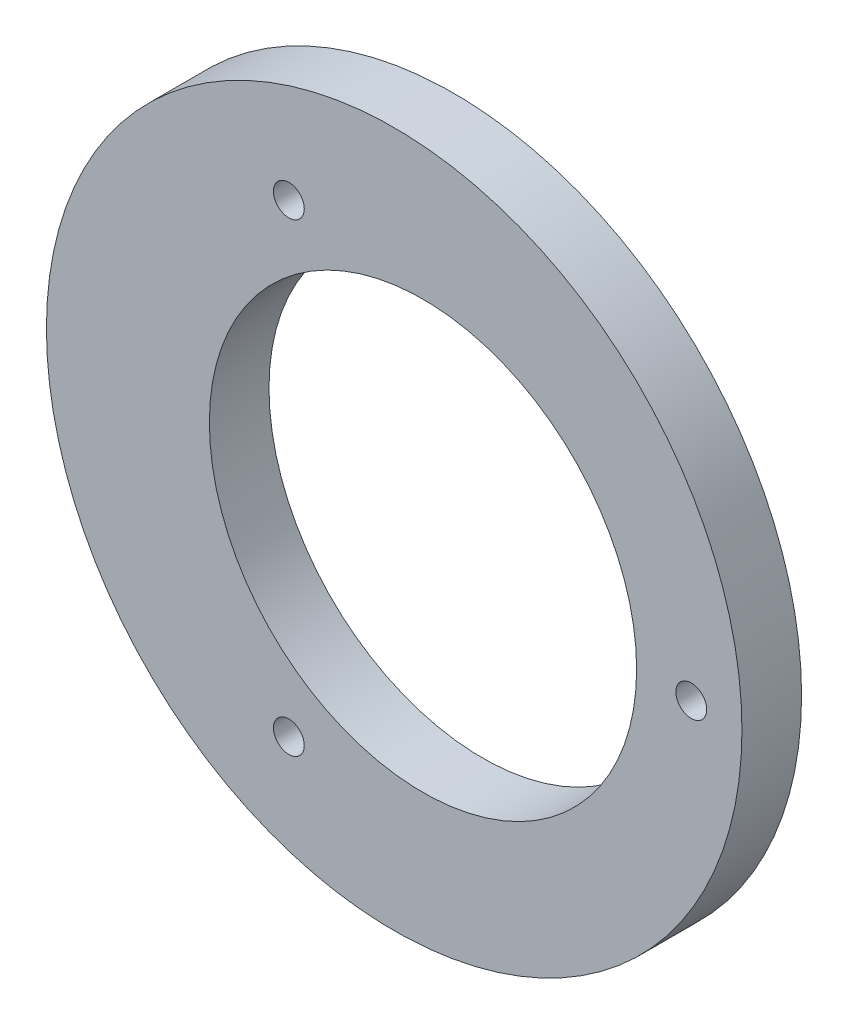
from build123d import *

# Parameters (mm, degrees)
SZKIC1_R                    = 35
DODANIE_WYCI_GNI_CIE1_DEPTH = 6
SZKIC3_R                    = 21.5
WYTNIJ_WYCI_GNI_CIE1_DEPTH  = 6
SZKIC4_R                    = 1.55
WYTNIJ_WYCI_GNI_CIE2_DEPTH  = 6


with BuildPart() as part:
    # Szkic1 → Dodanie-wyciągnięcie1 (new body)
    with BuildSketch(Plane.XY):
        with Locations((41.719839871, 20.384670663)):
            Circle(SZKIC1_R)
    extrude(amount=DODANIE_WYCI_GNI_CIE1_DEPTH)

    # Szkic3 → Wytnij-wyciągnięcie1 (cut)
    with BuildSketch(Plane.XY.offset(6)):
        with Locations((44.619839871, 20.384670663)):
            Circle(SZKIC3_R)
    extrude(amount=-WYTNIJ_WYCI_GNI_CIE1_DEPTH, mode=Mode.SUBTRACT)

    # Szkic4 → Wytnij-wyciągnięcie2 (cut)
    with BuildSketch(Plane.XY.offset(6)):
        with Locations((31.119839871, -2.99801524)):
            Circle(SZKIC4_R)
        with Locations((71.619839871, 20.384670663)):
            Circle(SZKIC4_R)
        with Locations((31.119839871, 43.767356565)):
            Circle(SZKIC4_R)
    extrude(amount=-WYTNIJ_WYCI_GNI_CIE2_DEPTH, mode=Mode.SUBTRACT)


solid = part.part
